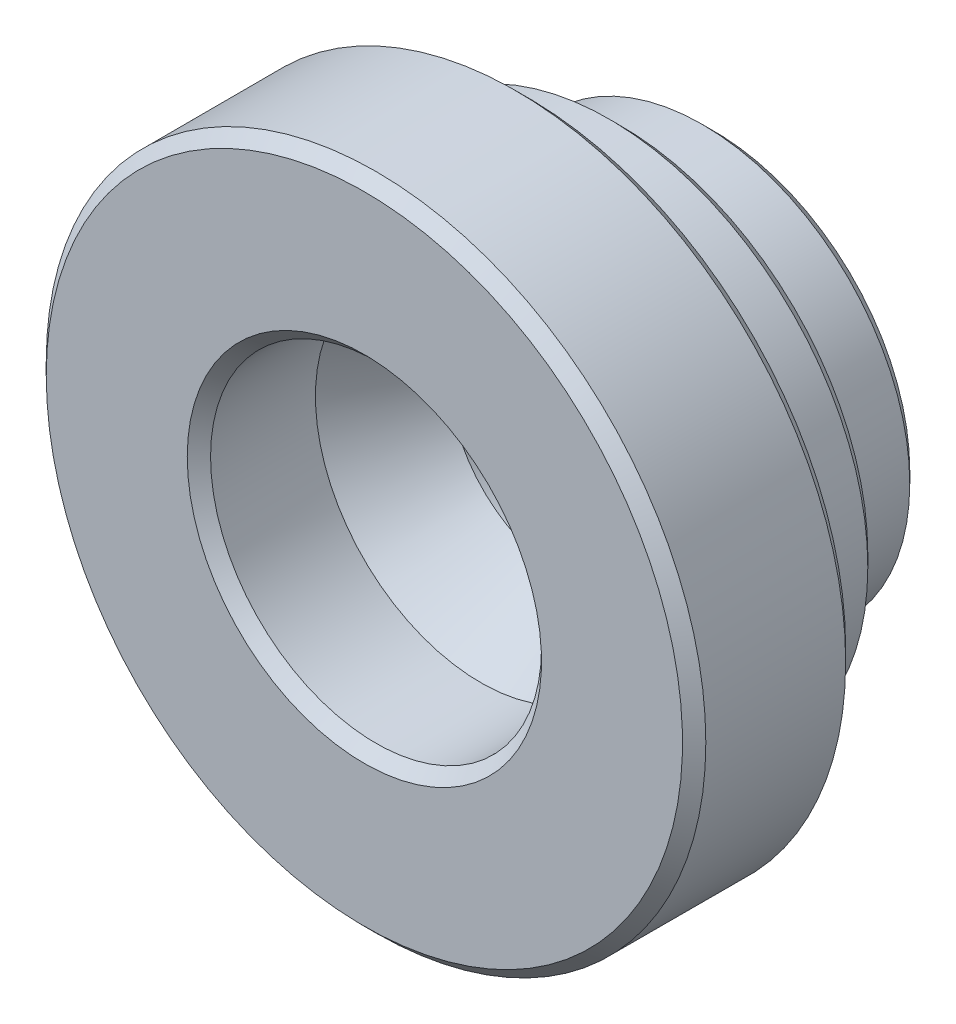
from build123d import *

# Parameters (mm, degrees)
CHAMFER1_SIZE = 0.5


with BuildPart() as part:
    # Sketch2 → Revolve1 (revolve)
    with BuildSketch(Plane(origin=(0, 0, 0), x_dir=(0, 0, -1), z_dir=(1, 0, 0)), mode=Mode.PRIVATE) as revolve1_sk:
        Polygon((15, 8.9), (11, 8.9), (11, 11.1), (7, 11.1), (7, 14.15), (0, 14.15), (0, 7.1), (5, 7.1), (8.637306696, 5), (15, 5), align=None)
    revolve(revolve1_sk.sketch.rotate(Axis((0, 0, 0), (0, 0, -1)), 90), axis=Axis((0, 0, 0), (0, 0, -1)))

    # Chamfer1
    chamfer1_edges = [part.edges().sort_by_distance(p)[0] for p in [
        (-14.15, 0, -7),
        (-11.1, 0, -11),
        (-8.9, 0, -15),
        (-7.1, 0, 0),
        (-14.15, 0, 0),
    ]]
    chamfer(chamfer1_edges, length=CHAMFER1_SIZE)


solid = part.part
